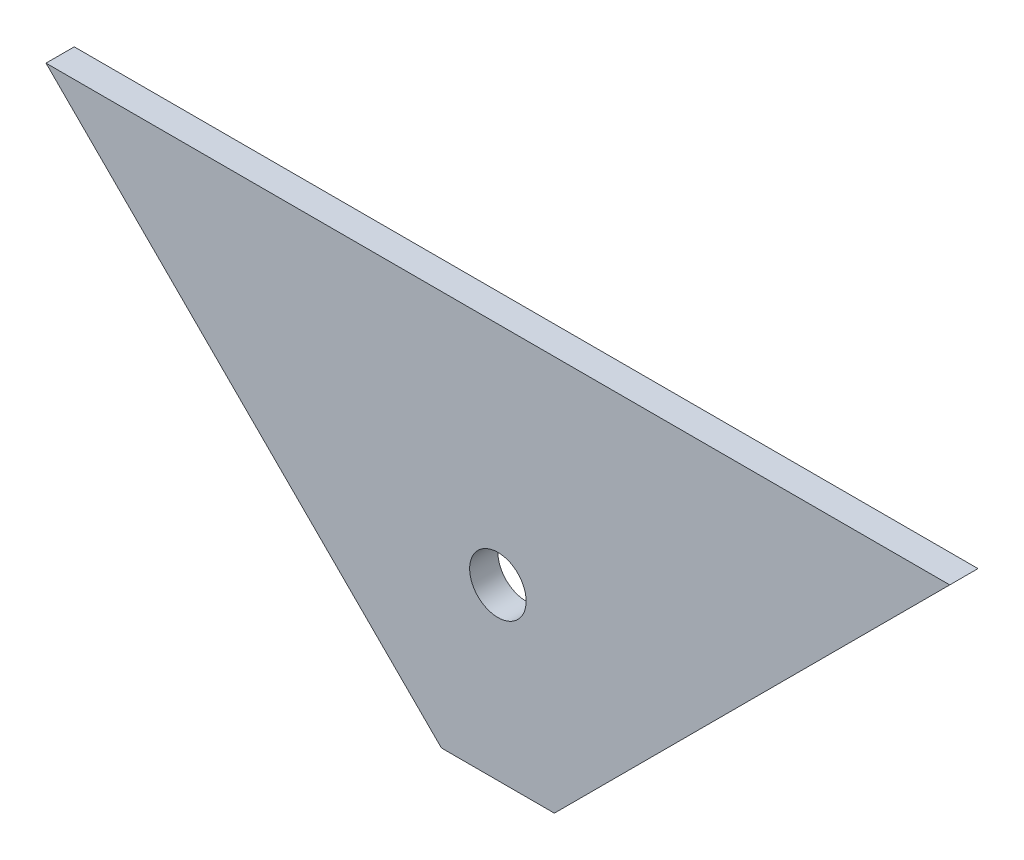
from build123d import *

# Parameters (mm, degrees)
BOSS_EXTRUDE1_DEPTH = 3.175
SKETCH2_R           = 6.35
CUT_EXTRUDE1_DEPTH  = 136.152108752


with BuildPart() as part:
    # Sketch1 → Boss-Extrude1 (new, symmetric)
    with BuildSketch(Plane.XY):
        Polygon((-101.6, 0), (-12.7, -88.9), (12.7, -88.9), (101.6, 0), align=None)
    extrude(amount=BOSS_EXTRUDE1_DEPTH, both=True)

    # Sketch2 → Cut-Extrude1 (cut, through all)
    with BuildSketch(Plane.XY.offset(3.175)):
        with Locations((0, -50.8)):
            Circle(SKETCH2_R)
    extrude(amount=-CUT_EXTRUDE1_DEPTH, mode=Mode.SUBTRACT)


solid = part.part
